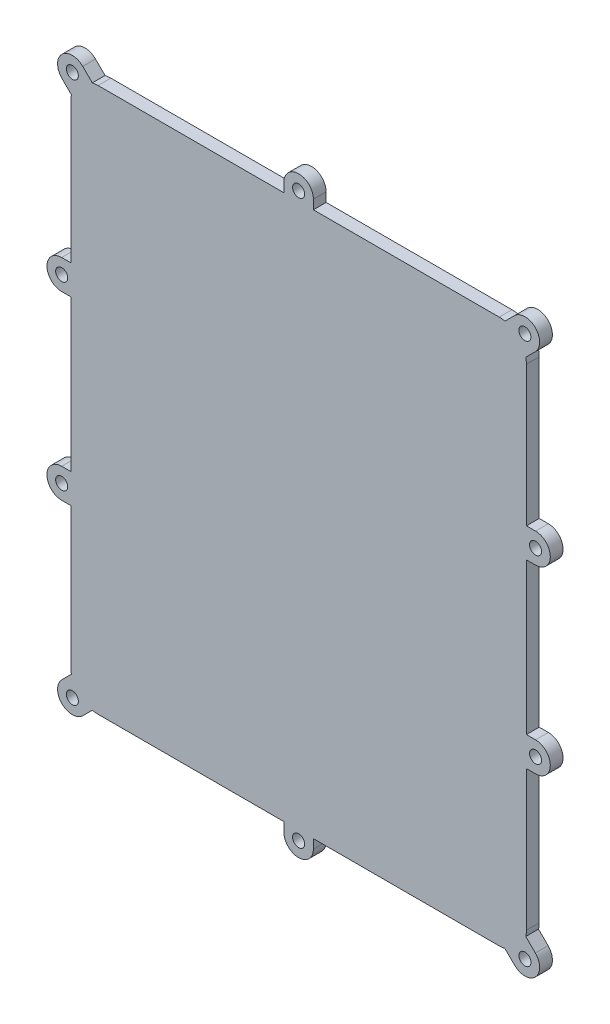
from build123d import *

# Parameters (mm, degrees)
BOSS_EXTRUDE1_DEPTH  = 4.7625
M4_CLEARANCE_HOLE1_D = 4.5


with BuildPart() as part:
    # Sketch1 → Boss-Extrude1 (new body)
    with BuildSketch(Plane.XY):
        with BuildLine():
            Line((139.473530069, 101.6), (70.133530069, 101.6))
            Line((70.133530069, 101.6), (70.133530069, 105.0097))
            ThreePointArc((70.133530069, 105.0097), (64.633530069, 110.5097), (59.133530069, 105.0097))
            Line((59.133530069, 105.0097), (59.133530069, 101.6))
            Line((59.133530069, 101.6), (-10.206469931, 101.6))
            ThreePointArc((-10.206469931, 101.6), (-11.288333767, 101.542235923), (-12.357895857, 101.36960052))
            Line((-12.357895857, 101.36960052), (-15.912609523, 104.924314185))
            ThreePointArc((-15.912609523, 104.924314185), (-23.690784116, 104.924314185), (-23.690784116, 97.146139592))
            Line((-23.690784116, 97.146139592), (-20.13607045, 93.591425927))
            ThreePointArc((-20.13607045, 93.591425927), (-20.308705854, 92.521863836), (-20.366469931, 91.44))
            Line((-20.366469931, 91.44), (-20.366469931, 39.225226889))
            Line((-20.366469931, 39.225226889), (-23.776169931, 39.225226889))
            ThreePointArc((-23.776169931, 39.225226889), (-29.276169931, 33.725226889), (-23.776169931, 28.225226889))
            Line((-23.776169931, 28.225226889), (-20.366469931, 28.225226889))
            Line((-20.366469931, 28.225226889), (-20.366469931, -28.225226889))
            Line((-20.366469931, -28.225226889), (-23.776169931, -28.225226889))
            ThreePointArc((-23.776169931, -28.225226889), (-29.276169931, -33.725226889), (-23.776169931, -39.225226889))
            Line((-23.776169931, -39.225226889), (-20.366469931, -39.225226889))
            Line((-20.366469931, -39.225226889), (-20.366469931, -91.44))
            ThreePointArc((-20.366469931, -91.44), (-20.308705854, -92.521863836), (-20.13607045, -93.591425927))
            Line((-20.13607045, -93.591425927), (-23.690784116, -97.146139592))
            ThreePointArc((-23.690784116, -97.146139592), (-23.690784116, -104.924314185), (-15.912609523, -104.924314185))
            Line((-15.912609523, -104.924314185), (-12.357895857, -101.36960052))
            ThreePointArc((-12.357895857, -101.36960052), (-11.288333767, -101.542235923), (-10.206469931, -101.6))
            Line((-10.206469931, -101.6), (59.133530069, -101.6))
            Line((59.133530069, -101.6), (59.133530069, -105.0097))
            ThreePointArc((59.133530069, -105.0097), (64.633530069, -110.5097), (70.133530069, -105.0097))
            Line((70.133530069, -105.0097), (70.133530069, -101.6))
            Line((70.133530069, -101.6), (139.473530069, -101.6))
            ThreePointArc((139.473530069, -101.6), (140.555393905, -101.542235923), (141.624955996, -101.36960052))
            Line((141.624955996, -101.36960052), (145.179669661, -104.924314185))
            ThreePointArc((145.179669661, -104.924314185), (152.957844254, -104.924314185), (152.957844254, -97.146139592))
            Line((152.957844254, -97.146139592), (149.403130589, -93.591425927))
            ThreePointArc((149.403130589, -93.591425927), (149.575765992, -92.521863836), (149.633530069, -91.44))
            Line((149.633530069, -91.44), (149.633530069, -39.225226889))
            Line((149.633530069, -39.225226889), (153.043230069, -39.225226889))
            ThreePointArc((153.043230069, -39.225226889), (158.543230069, -33.725226889), (153.043230069, -28.225226889))
            Line((153.043230069, -28.225226889), (149.633530069, -28.225226889))
            Line((149.633530069, -28.225226889), (149.633530069, 28.225226889))
            Line((149.633530069, 28.225226889), (153.043230069, 28.225226889))
            ThreePointArc((153.043230069, 28.225226889), (158.543230069, 33.725226889), (153.043230069, 39.225226889))
            Line((153.043230069, 39.225226889), (149.633530069, 39.225226889))
            Line((149.633530069, 39.225226889), (149.633530069, 91.44))
            ThreePointArc((149.633530069, 91.44), (149.575765992, 92.521863836), (149.403130589, 93.591425927))
            Line((149.403130589, 93.591425927), (152.957844254, 97.146139592))
            ThreePointArc((152.957844254, 97.146139592), (152.957844254, 104.924314185), (145.179669661, 104.924314185))
            Line((145.179669661, 104.924314185), (141.624955996, 101.36960052))
            ThreePointArc((141.624955996, 101.36960052), (140.555393905, 101.542235923), (139.473530069, 101.6))
        make_face()
    extrude(amount=BOSS_EXTRUDE1_DEPTH)

    # M4 Clearance Hole1 (through all)
    with Locations(Plane.XY.offset(4.7625)):
        with Locations((-19.801696819, -101.035226889), (-23.776169931, -33.725226889), (-23.776169931, 33.725226889), (-19.801696819, 101.035226889), (64.633530069, 105.0097), (149.068756958, 101.035226889), (153.043230069, 33.725226889), (153.043230069, -33.725226889), (149.068756958, -101.035226889), (64.633530069, -105.0097)):
            Hole(M4_CLEARANCE_HOLE1_D / 2)


solid = part.part
